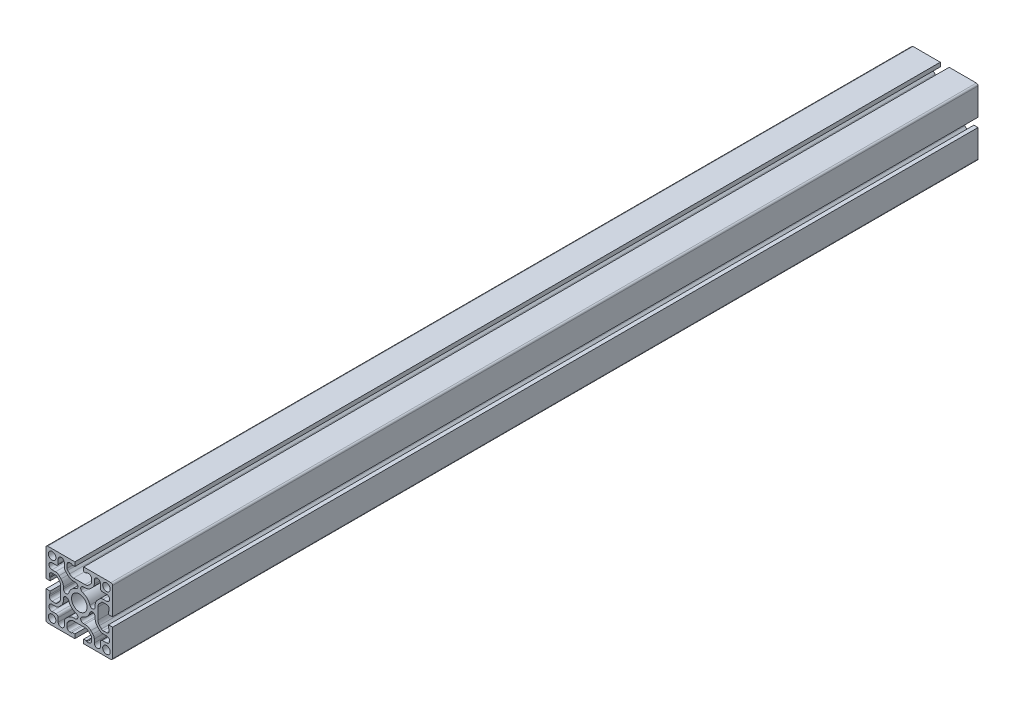
from build123d import *

# Parameters (mm, degrees)
SKETCH1_R           = 3.4
SKETCH1_R_2         = 7
BOSS_EXTRUDE1_DEPTH = 780


with BuildPart() as part:
    # Sketch1 → Boss-Extrude1 (new body)
    with BuildSketch(Plane(origin=(0, 0, 0), x_dir=(-1, 0, 0), z_dir=(0, 0, -1))):
        with BuildLine():
            Line((5.1, 16.8), (-5.11, 16.8))
            ThreePointArc((-5.11, 16.8), (-7.023417162, 17.180602337), (-8.645533906, 18.264466094))
            Line((-8.645533906, 18.264466094), (-10.42, 20.04))
            ThreePointArc((-10.42, 20.04), (-10.849063493, 20.687796578), (-11, 21.45))
            Line((-11, 21.45), (-11, 24.5))
            ThreePointArc((-11, 24.5), (-10.267766953, 26.267766953), (-8.5, 27))
            Line((-8.5, 27), (-7.07, 27))
            ThreePointArc((-7.07, 27), (-6.716446609, 26.853553391), (-6.57, 26.5))
            Line((-6.57, 26.5), (-6.57, 26.3))
            Line((-6.57, 26.3), (-4, 26.3))
            Line((-4, 26.3), (-4, 30))
            Line((-4, 30), (-28.5, 30))
            ThreePointArc((-28.5, 30), (-29.560660172, 29.560660172), (-30, 28.5))
            Line((-30, 28.5), (-30, 4))
            Line((-30, 4), (-26.3, 4))
            Line((-26.3, 4), (-26.3, 6.57))
            Line((-26.3, 6.57), (-26.500000003, 6.57))
            ThreePointArc((-26.500000003, 6.57), (-26.853553391, 6.716446609), (-27, 7.069999997))
            Line((-27, 7.069999997), (-27, 8.500000474))
            ThreePointArc((-27, 8.500000474), (-26.267767092, 10.267767092), (-24.500000474, 11))
            Line((-24.500000474, 11), (-21.45, 11))
            ThreePointArc((-21.45, 11), (-20.684633135, 10.847759065), (-20.035786438, 10.414213562))
            Line((-20.035786438, 10.414213562), (-18.27, 8.65))
            ThreePointArc((-18.27, 8.65), (-17.181928688, 7.026614358), (-16.8, 5.11))
            Line((-16.8, 5.11), (-16.8, -5.1))
            ThreePointArc((-16.8, -5.1), (-17.180602337, -7.013417162), (-18.264466094, -8.635533906))
            Line((-18.264466094, -8.635533906), (-20.04, -10.41))
            ThreePointArc((-20.04, -10.41), (-20.685169913, -10.847983768), (-21.45, -11))
            Line((-21.45, -11), (-24.5, -11))
            ThreePointArc((-24.5, -11), (-26.267766953, -10.267766953), (-27, -8.5))
            Line((-27, -8.5), (-27, -7.07))
            ThreePointArc((-27, -7.07), (-26.853553391, -6.716446609), (-26.5, -6.57))
            Line((-26.5, -6.57), (-26.3, -6.57))
            Line((-26.3, -6.57), (-26.3, -4))
            Line((-26.3, -4), (-30, -4))
            Line((-30, -4), (-30, -28.5))
            ThreePointArc((-30, -28.5), (-29.560660172, -29.560660172), (-28.5, -30))
            Line((-28.5, -30), (-4, -30))
            Line((-4, -30), (-4, -26.3))
            Line((-4, -26.3), (-6.57, -26.3))
            Line((-6.57, -26.3), (-6.57, -26.5))
            ThreePointArc((-6.57, -26.5), (-6.716446609, -26.853553391), (-7.07, -27))
            Line((-7.07, -27), (-8.5, -27))
            ThreePointArc((-8.5, -27), (-10.267766953, -26.267766953), (-11, -24.5))
            Line((-11, -24.5), (-11, -21.45))
            ThreePointArc((-11, -21.45), (-10.847759065, -20.684633135), (-10.414213562, -20.035786438))
            Line((-10.414213562, -20.035786438), (-8.65, -18.26))
            ThreePointArc((-8.65, -18.26), (-7.024002341, -17.180843639), (-5.11, -16.8))
            Line((-5.11, -16.8), (5.1, -16.8))
            ThreePointArc((5.1, -16.8), (7.014002341, -17.180843639), (8.64, -18.26))
            Line((8.64, -18.26), (10.41, -20.03))
            ThreePointArc((10.41, -20.03), (10.846363066, -20.681264642), (11, -21.45))
            Line((11, -21.45), (11, -24.5))
            ThreePointArc((11, -24.5), (10.267766953, -26.267766953), (8.5, -27))
            Line((8.5, -27), (7.07, -27))
            ThreePointArc((7.07, -27), (6.716446609, -26.853553391), (6.57, -26.5))
            Line((6.57, -26.5), (6.57, -26.3))
            Line((6.57, -26.3), (4, -26.3))
            Line((4, -26.3), (4, -30))
            Line((4, -30), (28.5, -30))
            ThreePointArc((28.5, -30), (29.560660172, -29.560660172), (30, -28.5))
            Line((30, -28.5), (30, -4))
            Line((30, -4), (26.3, -4))
            Line((26.3, -4), (26.3, -6.57))
            Line((26.3, -6.57), (26.5, -6.57))
            ThreePointArc((26.5, -6.57), (26.853553391, -6.716446609), (27, -7.07))
            Line((27, -7.07), (27, -8.5))
            ThreePointArc((27, -8.5), (26.267766953, -10.267766953), (24.5, -11))
            Line((24.5, -11), (21.45, -11))
            ThreePointArc((21.45, -11), (20.684633135, -10.847759065), (20.035786438, -10.414213562))
            Line((20.035786438, -10.414213562), (18.26, -8.64))
            ThreePointArc((18.26, -8.64), (17.180843639, -7.014002341), (16.8, -5.1))
            Line((16.8, -5.1), (16.8, 5.11))
            ThreePointArc((16.8, 5.11), (17.180843639, 7.024002341), (18.26, 8.65))
            Line((18.26, 8.65), (20.035786438, 10.414213562))
            ThreePointArc((20.035786438, 10.414213562), (20.684633135, 10.847759065), (21.45, 11))
            Line((21.45, 11), (24.5, 11))
            ThreePointArc((24.5, 11), (26.267766953, 10.267766953), (27, 8.5))
            Line((27, 8.5), (27, 7.07))
            ThreePointArc((27, 7.07), (26.853553391, 6.716446609), (26.5, 6.57))
            Line((26.5, 6.57), (26.3, 6.57))
            Line((26.3, 6.57), (26.3, 4))
            Line((26.3, 4), (30, 4))
            Line((30, 4), (30, 28.5))
            ThreePointArc((30, 28.5), (29.560660172, 29.560660172), (28.5, 30))
            Line((28.5, 30), (4, 30))
            Line((4, 30), (4, 26.3))
            Line((4, 26.3), (6.57, 26.3))
            Line((6.57, 26.3), (6.57, 26.5))
            ThreePointArc((6.57, 26.5), (6.71641961, 26.85358039), (7.07, 27))
            Line((7.07, 27), (8.5, 27))
            ThreePointArc((8.5, 27), (10.267766953, 26.267766953), (11, 24.5))
            Line((11, 24.5), (11, 21.45))
            ThreePointArc((11, 21.45), (10.847759065, 20.684633135), (10.414213562, 20.035786438))
            Line((10.414213562, 20.035786438), (8.64, 18.27))
            ThreePointArc((8.64, 18.27), (7.016614358, 17.181928688), (5.1, 16.8))
        make_face()
        with Locations(Location((-24.5, 24.5, 0), (0, 0, 180))):
            Circle(SKETCH1_R, mode=Mode.SUBTRACT)
        with Locations(Location((24.5, 24.5, 0), (0, 0, 180))):
            Circle(SKETCH1_R, mode=Mode.SUBTRACT)
        with Locations(Location((-24.5, -24.49, 0), (0, 0, 180))):
            Circle(SKETCH1_R, mode=Mode.SUBTRACT)
        with Locations(Location((24.5, -24.49, 0), (0, 0, 180))):
            Circle(SKETCH1_R, mode=Mode.SUBTRACT)
        with Locations(Location((0, 0, 0), (0, 0, 180))):
            Circle(SKETCH1_R_2, mode=Mode.SUBTRACT)
        with BuildLine():
            Line((5.103398282, -14.3), (3.678409373, -14.3))
            ThreePointArc((3.678409373, -14.3), (1.27735351, -12.23505015), (2.959678316, -9.551979076))
            ThreePointArc((2.959678316, -9.551979076), (7.071067812, -7.071067812), (9.551979076, -2.959678316))
            ThreePointArc((9.551979076, -2.959678316), (12.23505015, -1.27735351), (14.3, -3.678409373))
            Line((14.3, -3.678409373), (14.3, -5.11339393))
            ThreePointArc((14.3, -5.11339393), (14.86686796, -7.973757565), (16.481781365, -10.401734932))
            Line((16.481781365, -10.401734932), (18.243100081, -12.173004601))
            ThreePointArc((18.243100081, -12.173004601), (19.706101967, -13.155028322), (21.434031262, -13.5))
            Line((21.434031262, -13.5), (24.6, -13.5))
            ThreePointArc((24.6, -13.5), (27.35, -16.25), (24.6, -19))
            Line((24.6, -19), (21, -19))
            ThreePointArc((21, -19), (19.585786438, -19.585786438), (19, -21))
            Line((19, -21), (19, -24.6))
            ThreePointArc((19, -24.6), (16.25, -27.35), (13.5, -24.6))
            Line((13.5, -24.6), (13.5, -21.453961031))
            ThreePointArc((13.5, -21.453961031), (13.157457896, -19.731885585), (12.181980515, -18.271980515))
            Line((12.181980515, -18.271980515), (10.406699141, -16.496699141))
            ThreePointArc((10.406699141, -16.496699141), (7.973524025, -14.870903506), (5.103398282, -14.3))
        make_face(mode=Mode.SUBTRACT)
        with BuildLine():
            Line((-3.678409373, -14.3), (-5.103398282, -14.3))
            ThreePointArc((-5.103398282, -14.3), (-7.973524025, -14.870903506), (-10.406699141, -16.496699141))
            Line((-10.406699141, -16.496699141), (-12.181980515, -18.271980515))
            ThreePointArc((-12.181980515, -18.271980515), (-13.157457896, -19.731885585), (-13.5, -21.453961031))
            Line((-13.5, -21.453961031), (-13.5, -24.6))
            ThreePointArc((-13.5, -24.6), (-16.25, -27.35), (-19, -24.6))
            Line((-19, -24.6), (-19, -21))
            ThreePointArc((-19, -21), (-19.585786438, -19.585786438), (-21, -19))
            Line((-21, -19), (-24.6, -19))
            ThreePointArc((-24.6, -19), (-27.35, -16.25), (-24.6, -13.5))
            Line((-24.6, -13.5), (-21.434031262, -13.5))
            ThreePointArc((-21.434031262, -13.5), (-19.706101967, -13.155028322), (-18.243100081, -12.173004601))
            Line((-18.243100081, -12.173004601), (-16.481781365, -10.401734932))
            ThreePointArc((-16.481781365, -10.401734932), (-14.86686796, -7.973757565), (-14.3, -5.11339393))
            Line((-14.3, -5.11339393), (-14.3, -3.678409373))
            ThreePointArc((-14.3, -3.678409373), (-12.23505015, -1.27735351), (-9.551979076, -2.959678316))
            ThreePointArc((-9.551979076, -2.959678316), (-7.071067812, -7.071067812), (-2.959678316, -9.551979076))
            ThreePointArc((-2.959678316, -9.551979076), (-1.27735351, -12.23505015), (-3.678409373, -14.3))
        make_face(mode=Mode.SUBTRACT)
        with BuildLine():
            Line((-5.103398282, 14.3), (-3.678409373, 14.3))
            ThreePointArc((-3.678409373, 14.3), (-1.27735351, 12.23505015), (-2.959678316, 9.551979076))
            ThreePointArc((-2.959678316, 9.551979076), (-7.071067812, 7.071067812), (-9.551979076, 2.959678316))
            ThreePointArc((-9.551979076, 2.959678316), (-12.23505015, 1.27735351), (-14.3, 3.678409373))
            Line((-14.3, 3.678409373), (-14.3, 5.11339393))
            ThreePointArc((-14.3, 5.11339393), (-14.86686796, 7.973757565), (-16.481781365, 10.401734932))
            Line((-16.481781365, 10.401734932), (-18.243100081, 12.173004601))
            ThreePointArc((-18.243100081, 12.173004601), (-19.706101967, 13.155028322), (-21.434031262, 13.5))
            Line((-21.434031262, 13.5), (-24.6, 13.5))
            ThreePointArc((-24.6, 13.5), (-27.35, 16.25), (-24.6, 19))
            Line((-24.6, 19), (-21, 19))
            ThreePointArc((-21, 19), (-19.585786438, 19.585786438), (-19, 21))
            Line((-19, 21), (-19, 24.6))
            ThreePointArc((-19, 24.6), (-16.25, 27.35), (-13.5, 24.6))
            Line((-13.5, 24.6), (-13.5, 21.453961031))
            ThreePointArc((-13.5, 21.453961031), (-13.157457896, 19.731885585), (-12.181980515, 18.271980515))
            Line((-12.181980515, 18.271980515), (-10.406699141, 16.496699141))
            ThreePointArc((-10.406699141, 16.496699141), (-7.973524025, 14.870903506), (-5.103398282, 14.3))
        make_face(mode=Mode.SUBTRACT)
        with BuildLine():
            Line((3.678409373, 14.3), (5.103398282, 14.3))
            ThreePointArc((5.103398282, 14.3), (7.973524025, 14.870903506), (10.406699141, 16.496699141))
            Line((10.406699141, 16.496699141), (12.181980515, 18.271980515))
            ThreePointArc((12.181980515, 18.271980515), (13.157457896, 19.731885585), (13.5, 21.453961031))
            Line((13.5, 21.453961031), (13.5, 24.6))
            ThreePointArc((13.5, 24.6), (16.25, 27.35), (19, 24.6))
            Line((19, 24.6), (19, 21))
            ThreePointArc((19, 21), (19.585786438, 19.585786438), (21, 19))
            Line((21, 19), (24.6, 19))
            ThreePointArc((24.6, 19), (27.35, 16.25), (24.6, 13.5))
            Line((24.6, 13.5), (21.434031262, 13.5))
            ThreePointArc((21.434031262, 13.5), (19.706101967, 13.155028322), (18.243100081, 12.173004601))
            Line((18.243100081, 12.173004601), (16.481781365, 10.401734932))
            ThreePointArc((16.481781365, 10.401734932), (14.86686796, 7.973757565), (14.3, 5.11339393))
            Line((14.3, 5.11339393), (14.3, 3.678409373))
            ThreePointArc((14.3, 3.678409373), (12.23505015, 1.27735351), (9.551979076, 2.959678316))
            ThreePointArc((9.551979076, 2.959678316), (7.071067812, 7.071067812), (2.959678316, 9.551979076))
            ThreePointArc((2.959678316, 9.551979076), (1.27735351, 12.23505015), (3.678409373, 14.3))
        make_face(mode=Mode.SUBTRACT)
    extrude(amount=-BOSS_EXTRUDE1_DEPTH)


solid = part.part
